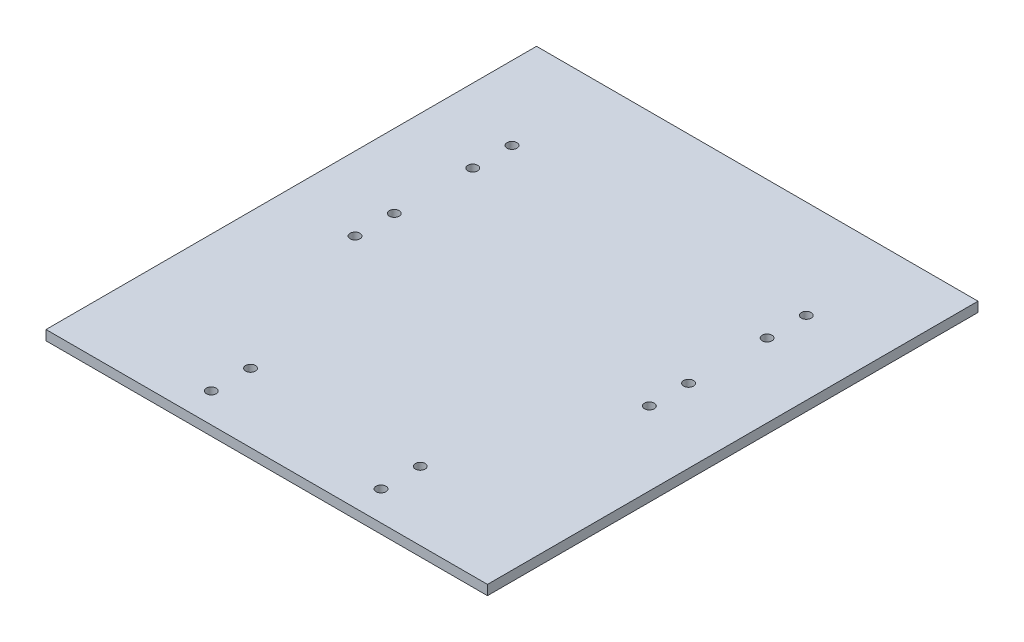
from build123d import *

# Parameters (mm, degrees)
SKETCH1_W            = 225
SKETCH1_H            = 250
BODY_DEPTH           = 5
SKETCH2_R            = 2.5
FIXATION_HOLES_DEPTH = 169.244613584
SKETCH3_R            = 2.5
HOLES_DEPTH          = 169.244613584


with BuildPart() as part:
    # Sketch1 → Body (new body)
    with BuildSketch(Plane(origin=(0, 0, 0), x_dir=(1, 0, 0), z_dir=(0, 1, 0))):
        Rectangle(SKETCH1_W, SKETCH1_H)
    extrude(amount=BODY_DEPTH)

    # Sketch2 → Fixation_Holes (cut, through all)
    with BuildSketch(Plane(origin=(0, 5, 0), x_dir=(1, 0, 0), z_dir=(0, 1, 0))):
        with Locations(Location((-75, 75, 0), (0, 0, 270))):
            Circle(SKETCH2_R)
        with Locations(Location((-75, 55, 0), (0, 0, 270))):
            Circle(SKETCH2_R)
        with Locations(Location((75, 55, 0), (0, 0, 90))):
            Circle(SKETCH2_R)
        with Locations(Location((75, 75, 0), (0, 0, 90))):
            Circle(SKETCH2_R)
        with Locations(Location((75, -5, 0), (0, 0, 270))):
            Circle(SKETCH2_R)
        with Locations(Location((75, 15, 0), (0, 0, 270))):
            Circle(SKETCH2_R)
        with Locations(Location((-75, -5, 0), (0, 0, 90))):
            Circle(SKETCH2_R)
        with Locations(Location((-75, 15, 0), (0, 0, 90))):
            Circle(SKETCH2_R)
    extrude(amount=-FIXATION_HOLES_DEPTH, mode=Mode.SUBTRACT)

    # Sketch3 → Holes (cut, through all)
    with BuildSketch(Plane(origin=(0, 5, 0), x_dir=(1, 0, 0), z_dir=(0, 1, 0))):
        with Locations(Location((-43.25, -90, 0), (0, 0, 270))):
            Circle(SKETCH3_R)
        with Locations(Location((-43.25, -110, 0), (0, 0, 270))):
            Circle(SKETCH3_R)
        with Locations(Location((43.25, -90, 0), (0, 0, 90))):
            Circle(SKETCH3_R)
        with Locations(Location((43.25, -110, 0), (0, 0, 90))):
            Circle(SKETCH3_R)
    extrude(amount=-HOLES_DEPTH, mode=Mode.SUBTRACT)


solid = part.part
